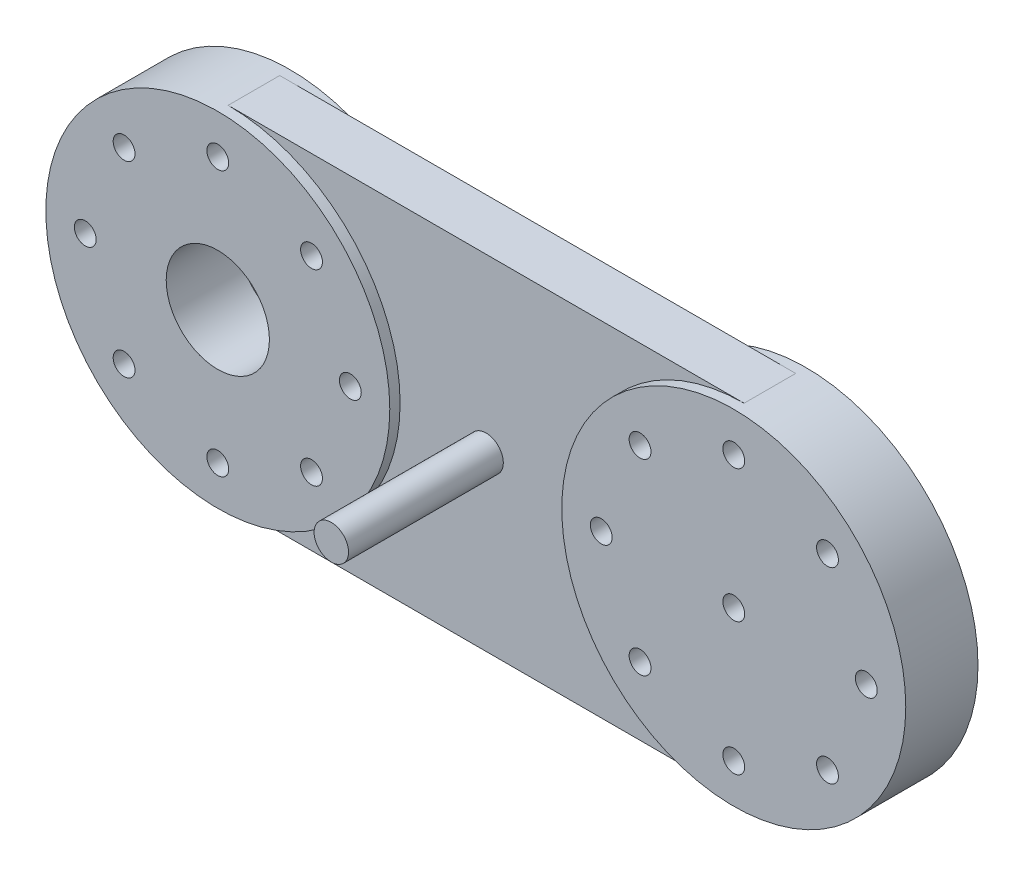
from build123d import *

# Parameters (mm, degrees)
SKETCH_1_W               = 150
SKETCH_1_H               = 100
SHORT_ARM_BODY_DEPTH     = 15
SKETCH_1_17_R            = 5
EXTRUDE_8_DEPTH          = 45
SKETCH_1_30_R            = 50
SKETCH_1_30_R_2          = 3.175
EXTRUDE_10_DEPTH         = 3
CUT_EXTRUDE_1_DEPTH      = 88
CUT_EXTRUDE_1_DEPTH_BACK = 59
SKETCH_1_31_R            = 50
EXTRUDE_12_DEPTH         = 3
EXTRUDE_12_DEPTH_BACK    = 18
SKETCH_1_33_R            = 50
SKETCH_1_33_R_2          = 3.175
SKETCH_3_R               = 15
CUT_EXTRUDE_3_DEPTH      = 98


with BuildPart() as part:
    # 草图1 → short_arm_body (new body)
    with BuildSketch(Plane.XY):
        with Locations((-75, 50)):
            Rectangle(SKETCH_1_W, SKETCH_1_H)
    extrude(amount=-SHORT_ARM_BODY_DEPTH)

    # 草图1<17> → 凸台-拉伸8 (add)
    with BuildSketch(Plane.XY):
        with Locations(Location((-75, 50, 0), (0, 0, 180))):
            Circle(SKETCH_1_17_R)
    extrude(amount=EXTRUDE_8_DEPTH)

    # 草图1<30> → 凸台-拉伸10 (add)
    with BuildSketch(Plane.XY):
        with Locations(Location((0, 50, 0), (0, 0, 270))):
            Circle(SKETCH_1_30_R)
        with Locations(Location((0, 11.469660941, 0), (0, 0, 90))):
            Circle(SKETCH_1_30_R_2, mode=Mode.SUBTRACT)
        with BuildLine():
            Line((0, 25), (0, 46.825))
            ThreePointArc((0, 46.825), (-2.24506403, 47.75493597), (-3.175, 50))
            Line((-3.175, 50), (-25, 50))
            ThreePointArc((-25, 50), (17.67766953, 67.67766953), (0, 25))
        make_face(mode=Mode.SUBTRACT)
        with Locations(Location((0, 88.530339059, 0), (0, 0, 90))):
            Circle(SKETCH_1_30_R_2, mode=Mode.SUBTRACT)
        with Locations((-38.530339059, 50)):
            Circle(SKETCH_1_30_R_2, mode=Mode.SUBTRACT)
        with Locations((-27.24506403, 77.24506403)):
            Circle(SKETCH_1_30_R_2, mode=Mode.SUBTRACT)
        with Locations((-27.24506403, 22.75493597)):
            Circle(SKETCH_1_30_R_2, mode=Mode.SUBTRACT)
        with Locations((27.24506403, 77.24506403)):
            Circle(SKETCH_1_30_R_2, mode=Mode.SUBTRACT)
        with Locations((38.530339059, 50)):
            Circle(SKETCH_1_30_R_2, mode=Mode.SUBTRACT)
        with Locations((27.24506403, 22.75493597)):
            Circle(SKETCH_1_30_R_2, mode=Mode.SUBTRACT)
    extrude(amount=EXTRUDE_10_DEPTH)

    # 草图1<31> → 切除-拉伸1 (cut, two sides: drawn at the far end of the back side and taken through both)
    with BuildSketch(Plane.XY.offset(-CUT_EXTRUDE_1_DEPTH_BACK)):
        with Locations((0, 50)):
            Circle(SKETCH_1_31_R)
        with Locations((-150, 50)):
            Circle(SKETCH_1_31_R)
    extrude(amount=CUT_EXTRUDE_1_DEPTH + CUT_EXTRUDE_1_DEPTH_BACK, mode=Mode.SUBTRACT)

    # 草图1<33> → 凸台-拉伸12 (add, two sides: drawn at the far end of the back side and taken through both)
    # profile 1 of 2: a face of its own
    with BuildSketch(Plane.XY.offset(-EXTRUDE_12_DEPTH_BACK)):
        with Locations((0, 50)):
            Circle(SKETCH_1_33_R)
        with Locations((38.530339059, 50)):
            Circle(SKETCH_1_33_R_2, mode=Mode.SUBTRACT)
        with Locations((27.24506403, 22.75493597)):
            Circle(SKETCH_1_33_R_2, mode=Mode.SUBTRACT)
        with Locations((0, 11.469660941)):
            Circle(SKETCH_1_33_R_2, mode=Mode.SUBTRACT)
        with Locations((-27.24506403, 22.75493597)):
            Circle(SKETCH_1_33_R_2, mode=Mode.SUBTRACT)
        with Locations((-38.530339059, 50)):
            Circle(SKETCH_1_33_R_2, mode=Mode.SUBTRACT)
        with Locations((-27.24506403, 77.24506403)):
            Circle(SKETCH_1_33_R_2, mode=Mode.SUBTRACT)
        with Locations((0, 88.530339059)):
            Circle(SKETCH_1_33_R_2, mode=Mode.SUBTRACT)
        with Locations((27.24506403, 77.24506403)):
            Circle(SKETCH_1_33_R_2, mode=Mode.SUBTRACT)
        with Locations((0, 50)):
            Circle(SKETCH_1_33_R_2, mode=Mode.SUBTRACT)
    # profile 2 of 2: a face of its own
    with BuildSketch(Plane.XY.offset(-EXTRUDE_12_DEPTH_BACK)):
        with Locations((-150, 50)):
            Circle(SKETCH_1_33_R)
        with Locations((-111.469660941, 50)):
            Circle(SKETCH_1_33_R_2, mode=Mode.SUBTRACT)
        with Locations((-122.75493597, 22.75493597)):
            Circle(SKETCH_1_33_R_2, mode=Mode.SUBTRACT)
        with Locations((-150, 11.469660941)):
            Circle(SKETCH_1_33_R_2, mode=Mode.SUBTRACT)
        with Locations((-177.24506403, 22.75493597)):
            Circle(SKETCH_1_33_R_2, mode=Mode.SUBTRACT)
        with Locations((-188.530339059, 50)):
            Circle(SKETCH_1_33_R_2, mode=Mode.SUBTRACT)
        with Locations((-177.24506403, 77.24506403)):
            Circle(SKETCH_1_33_R_2, mode=Mode.SUBTRACT)
        with Locations((-150, 88.530339059)):
            Circle(SKETCH_1_33_R_2, mode=Mode.SUBTRACT)
        with Locations((-122.75493597, 77.24506403)):
            Circle(SKETCH_1_33_R_2, mode=Mode.SUBTRACT)
        with Locations((-150, 50)):
            Circle(SKETCH_1_33_R_2, mode=Mode.SUBTRACT)
    extrude(amount=EXTRUDE_12_DEPTH + EXTRUDE_12_DEPTH_BACK)

    # 草图3 → 切除-拉伸3 (cut)
    with BuildSketch(Plane(origin=(0, 0, -18), x_dir=(-1, 0, 0), z_dir=(0, 0, -1))):
        with Locations((150, 50)):
            Circle(SKETCH_3_R)
    extrude(amount=-CUT_EXTRUDE_3_DEPTH, mode=Mode.SUBTRACT)


solid = part.part
